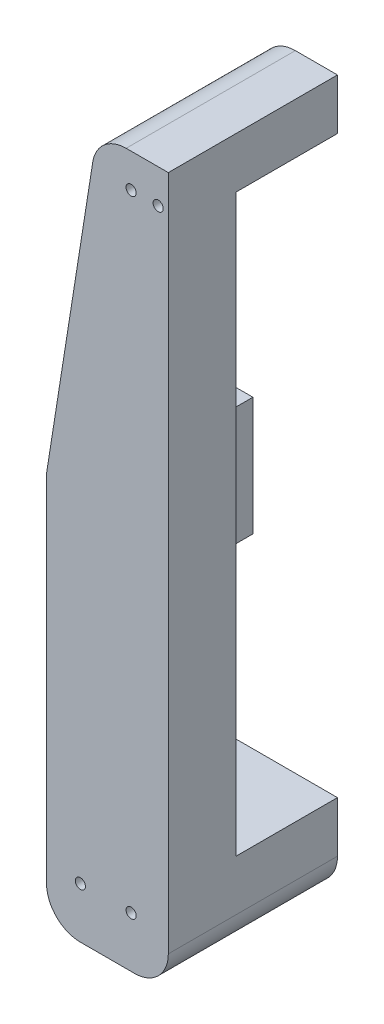
from build123d import *

# Parameters (mm, degrees)
CROQUIS1_R              = 1.5
SALIENTE_EXTRUIR1_DEPTH = 50
CORTAR_EXTRUIR1_REACH   = 211.275
CROQUIS2_W              = 30
CROQUIS2_H              = 170
REDONDEO1_R             = 10
REDONDEO2_R             = 10
CROQUIS3_W              = 11
CROQUIS3_H              = 35
CROQUIS3_R              = 1.5
SALIENTE_EXTRUIR2_DEPTH = 30


with BuildPart() as part:
    # Croquis1 → Saliente-Extruir1 (new body)
    with BuildSketch(Plane(origin=(0, 0, 0), x_dir=(0, 1, 0), z_dir=(0, 0, 1))):
        Polygon((-85, 25), (10, 10), (10, -11), (-200, -11), (-200, 25), align=None)
        with Locations(Location((0, 0, 0), (0, 0, 270))):
            Circle(CROQUIS1_R, mode=Mode.SUBTRACT)
        with Locations(Location((-185, 0, 0), (0, 0, 270))):
            Circle(CROQUIS1_R, mode=Mode.SUBTRACT)
        with Locations(Location((-185, 15, 0), (0, 0, 270))):
            Circle(CROQUIS1_R, mode=Mode.SUBTRACT)
        with Locations(Location((0, -8, 0), (0, 0, 270))):
            Circle(CROQUIS1_R, mode=Mode.SUBTRACT)
    extrude(amount=SALIENTE_EXTRUIR1_DEPTH)

    # Croquis2 → Cortar-Extruir1 (cut, up to next)
    with BuildSketch(Plane(origin=(11, 0, 0), x_dir=(0, 0, -1), z_dir=(1, 0, 0)), mode=Mode.PRIVATE) as cortar_extruir1_sk1:
        with Locations((-15, -90)):
            Rectangle(CROQUIS2_W, CROQUIS2_H)
    cortar_extruir1_tool1 = extrude(cortar_extruir1_sk1.sketch, amount=-CORTAR_EXTRUIR1_REACH, mode=Mode.PRIVATE) & part.part
    add(cortar_extruir1_tool1.solids().sort_by_distance((11, -90, 15))[0], mode=Mode.SUBTRACT)

    # Redondeo1
    redondeo1_edges = [part.edges().sort_by_distance(p)[0] for p in [
        (11, -200, 25),
        (-25, -200, 25),
    ]]
    fillet(redondeo1_edges, radius=REDONDEO1_R)

    # Redondeo2
    redondeo2_edges = [part.edges().sort_by_distance(p)[0] for p in [
        (-10, 10, 25),
    ]]
    fillet(redondeo2_edges, radius=REDONDEO2_R)

    # Croquis3 → Saliente-Extruir2 (add)
    with BuildSketch(Plane(origin=(0, 0, 30), x_dir=(-1, 0, 0), z_dir=(0, 0, -1))):
        with Locations((19.5, -102.5)):
            Rectangle(CROQUIS3_W, CROQUIS3_H)
        with Locations(Location((19, -90, 0), (0, 0, 90))):
            Circle(CROQUIS3_R, mode=Mode.SUBTRACT)
        with Locations(Location((19, -110, 0), (0, 0, 90))):
            Circle(CROQUIS3_R, mode=Mode.SUBTRACT)
    extrude(amount=SALIENTE_EXTRUIR2_DEPTH)


solid = part.part
